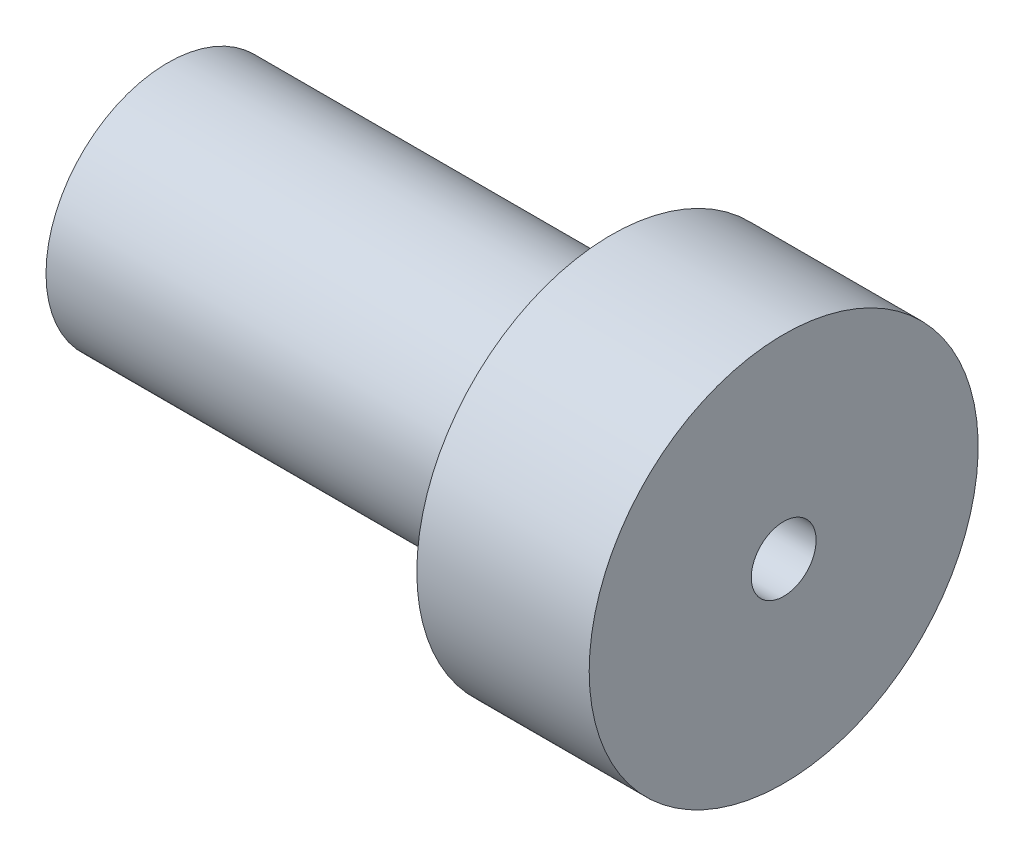
from build123d import *

# Parameters (mm, degrees)
SKETCH2_R          = 1
CUT_EXTRUDE2_DEPTH = 21.808652047


with BuildPart() as part:
    # Sketch1 → Revolve1 (revolve)
    with BuildSketch(Plane.XY, mode=Mode.PRIVATE) as revolve1_sk:
        Polygon((0, 0), (0, 3.757462687), (13.682835821, 3.757462687), (13.682835821, 6), (19, 6), (19, 0), align=None)
    revolve(revolve1_sk.sketch.rotate(Axis((-5.955223881, 0, 0), (1, 0, 0)), 90), axis=Axis((-5.955223881, 0, 0), (1, 0, 0)))

    # Sketch2 → Cut-Extrude2 (cut, through all)
    with BuildSketch(Plane(origin=(0, 0, 0), x_dir=(0, 0, -1), z_dir=(1, 0, 0))):
        Circle(SKETCH2_R)
    extrude(amount=CUT_EXTRUDE2_DEPTH, mode=Mode.SUBTRACT)


solid = part.part
